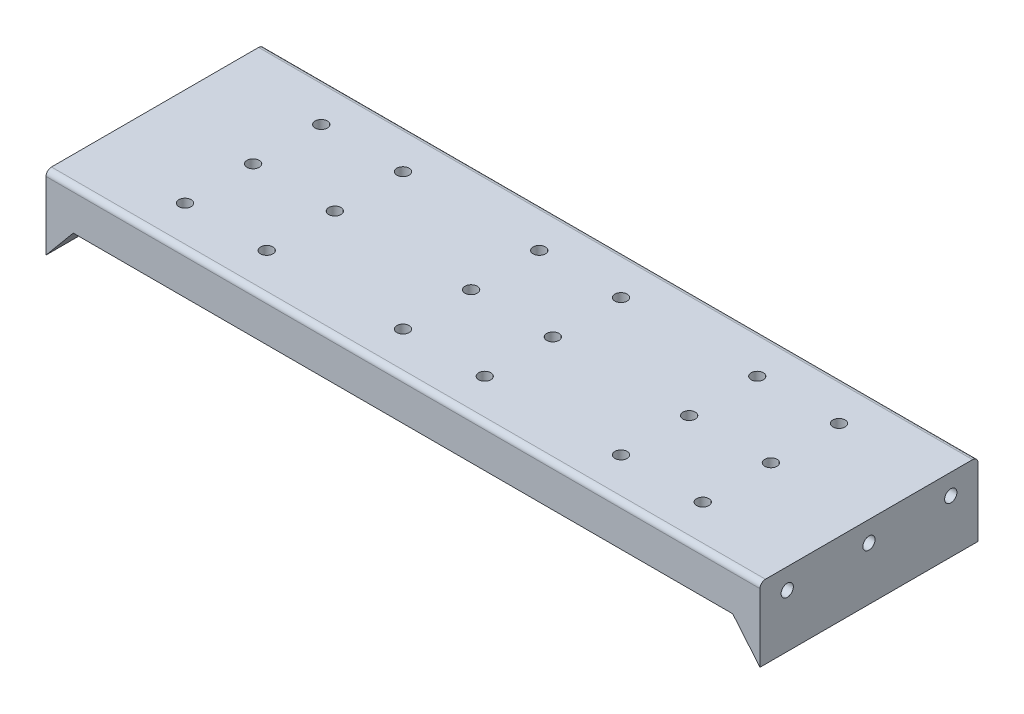
from build123d import *

# Parameters (mm, degrees)
SKETCH1_W           = 262
SKETCH1_H           = 80
BOSS_EXTRUDE1_DEPTH = 15
SKETCH2_R           = 2.25
CUT_EXTRUDE1_DEPTH  = 40
CUT_EXTRUDE2_DEPTH  = 3.2
SKETCH4_R           = 2.25
CUT_EXTRUDE3_DEPTH  = 138.789694825
LPATTERN1_COUNT     = 2
LPATTERN1_PITCH     = 80
LPATTERN1_COL_COUNT = 2
LPATTERN1_COL_PITCH = 80
FILLET1_R           = 2
BOSS_EXTRUDE2_DEPTH = 80


with BuildPart() as part:
    # Sketch1 → Boss-Extrude1 (new body)
    with BuildSketch(Plane(origin=(0, 0, 0), x_dir=(1, 0, 0), z_dir=(0, 1, 0))):
        Rectangle(SKETCH1_W, SKETCH1_H)
    extrude(amount=BOSS_EXTRUDE1_DEPTH)

    # Sketch2 → Cut-Extrude1 (cut)
    with BuildSketch(Plane.ZY.offset(131)):
        with Locations((0, 7.5)):
            Circle(SKETCH2_R)
        with Locations((-30, 7.5)):
            Circle(SKETCH2_R)
        with Locations(Location((30, 7.5, 0), (0, 0, 180))):
            Circle(SKETCH2_R)
    cut_extrude1 = extrude(amount=-CUT_EXTRUDE1_DEPTH, mode=Mode.SUBTRACT)

    # Sketch3 → Cut-Extrude2 (cut)
    with BuildSketch(Plane.ZY.offset(121)):
        Polygon((-33.75, 5.334936491), (-33.75, 0), (-26.25, 0), (-26.25, 5.334936491), (-26.25, 9.665063509), (-30, 11.830127019), (-33.75, 9.665063509), align=None)
        Polygon((0, 11.830127019), (-3.75, 9.665063509), (-3.75, 5.334936491), (-3.75, 0), (3.75, 0), (3.75, 5.334936491), (3.75, 9.665063509), align=None)
        Polygon((33.75, 5.334936491), (33.75, 0), (26.25, 0), (26.25, 5.334936491), (26.25, 9.665063509), (30, 11.830127019), (33.75, 9.665063509), align=None)
    cut_extrude2 = extrude(amount=-CUT_EXTRUDE2_DEPTH, mode=Mode.SUBTRACT)

    # Mirror1: Cut-Extrude1, Cut-Extrude2 across plane
    add(cut_extrude1.mirror(Plane(origin=(0, 0, 0), x_dir=(0, 0, 1), z_dir=(1, 0, 0))), mode=Mode.SUBTRACT)
    add(cut_extrude2.mirror(Plane(origin=(0, 0, 0), x_dir=(0, 0, 1), z_dir=(1, 0, 0))), mode=Mode.SUBTRACT)

    # Sketch4 → Cut-Extrude3 (cut, through all)
    with BuildSketch(Plane(origin=(0, 15, 0), x_dir=(1, 0, 0), z_dir=(0, 1, 0))):
        with Locations(Location((-15, 0, 0), (0, 0, 270))):
            Circle(SKETCH4_R)
        with Locations(Location((-15, 25, 0), (0, 0, 270))):
            Circle(SKETCH4_R)
        with Locations(Location((-15, -25, 0), (0, 0, 90))):
            Circle(SKETCH4_R)
        with Locations(Location((15, -25, 0), (0, 0, 270))):
            Circle(SKETCH4_R)
        with Locations(Location((15, 0, 0), (0, 0, 90))):
            Circle(SKETCH4_R)
        with Locations(Location((15, 25, 0), (0, 0, 90))):
            Circle(SKETCH4_R)
    cut_extrude3 = extrude(amount=-CUT_EXTRUDE3_DEPTH, mode=Mode.SUBTRACT)

    # LPattern1: Cut-Extrude3 ×2
    with Locations(*[(i * LPATTERN1_PITCH, 0, 0) for i in range(1, LPATTERN1_COUNT)]):
        add(cut_extrude3, mode=Mode.SUBTRACT)

    # LPattern1 col: Cut-Extrude3 ×2
    with Locations(*[(-i * LPATTERN1_COL_PITCH, 0, 0) for i in range(1, LPATTERN1_COL_COUNT)]):
        add(cut_extrude3, mode=Mode.SUBTRACT)

    # Fillet1
    fillet1_edges = [part.edges().sort_by_distance(p)[0] for p in [
        (0, 15, 40),
        (0, 15, -40),
    ]]
    fillet(fillet1_edges, radius=FILLET1_R)

    # Sketch7 → Boss-Extrude2 (add, through all)
    with BuildSketch(Plane.XY.offset(40)):
        Polygon((-131, 0), (-131, -12), (-121, 0), align=None)
    boss_extrude2 = extrude(amount=-BOSS_EXTRUDE2_DEPTH)

    # Mirror2: Boss-Extrude2 across plane
    add(boss_extrude2.mirror(Plane(origin=(0, 0, 0), x_dir=(0, 0, 1), z_dir=(1, 0, 0))))


solid = part.part
